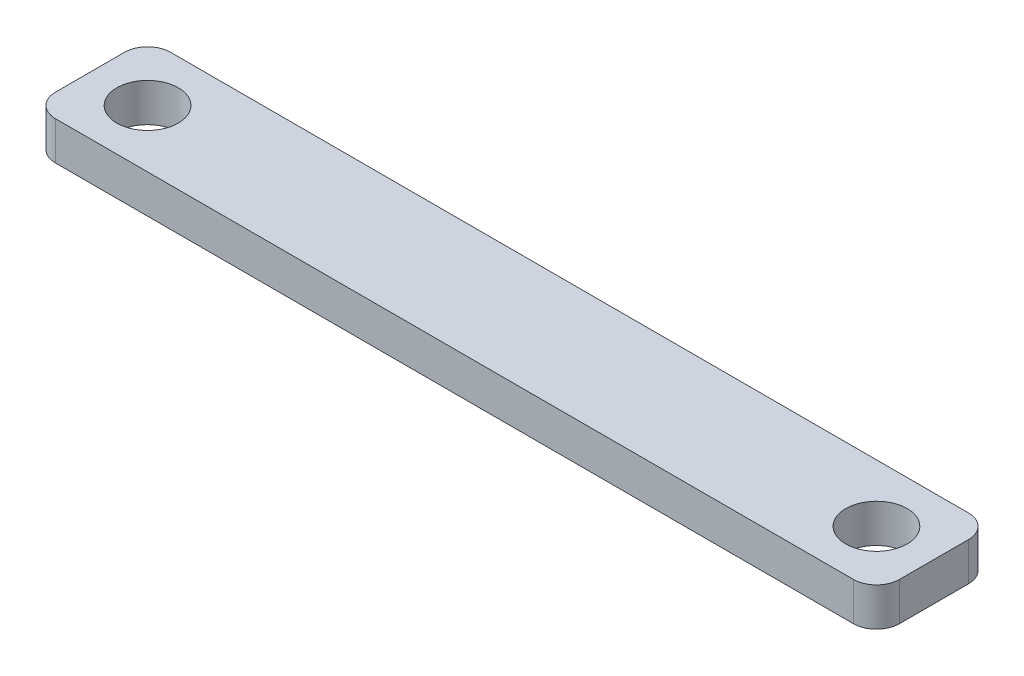
from build123d import *

# Parameters (mm, degrees)
CROQUIS1_W              = 110
CROQUIS1_H              = 15
SALIENTE_EXTRUIR1_DEPTH = 5
REDONDEO1_R             = 3
CROQUIS2_R              = 4
CORTAR_EXTRUIR1_DEPTH   = 56.733742024


with BuildPart() as part:
    # Croquis1 → Saliente-Extruir1 (new body)
    with BuildSketch(Plane(origin=(0, 0, 0), x_dir=(1, 0, 0), z_dir=(0, 1, 0))):
        Rectangle(CROQUIS1_W, CROQUIS1_H)
    extrude(amount=SALIENTE_EXTRUIR1_DEPTH)

    # Redondeo1
    redondeo1_edges = [part.edges().sort_by_distance(p)[0] for p in [
        (55, 2.5, 7.5),
        (-55, 2.5, 7.5),
        (-55, 2.5, -7.5),
        (55, 2.5, -7.5),
    ]]
    fillet(redondeo1_edges, radius=REDONDEO1_R)

    # Croquis2 → Cortar-Extruir1 (cut, through all)
    with BuildSketch(Plane(origin=(0, 5, 0), x_dir=(1, 0, 0), z_dir=(0, 1, 0))):
        with Locations(Location((-47.5, 0, 0), (0, 0, 270))):
            Circle(CROQUIS2_R)
        with Locations(Location((47.5, 0, 0), (0, 0, 270))):
            Circle(CROQUIS2_R)
    extrude(amount=-CORTAR_EXTRUIR1_DEPTH, mode=Mode.SUBTRACT)


solid = part.part
